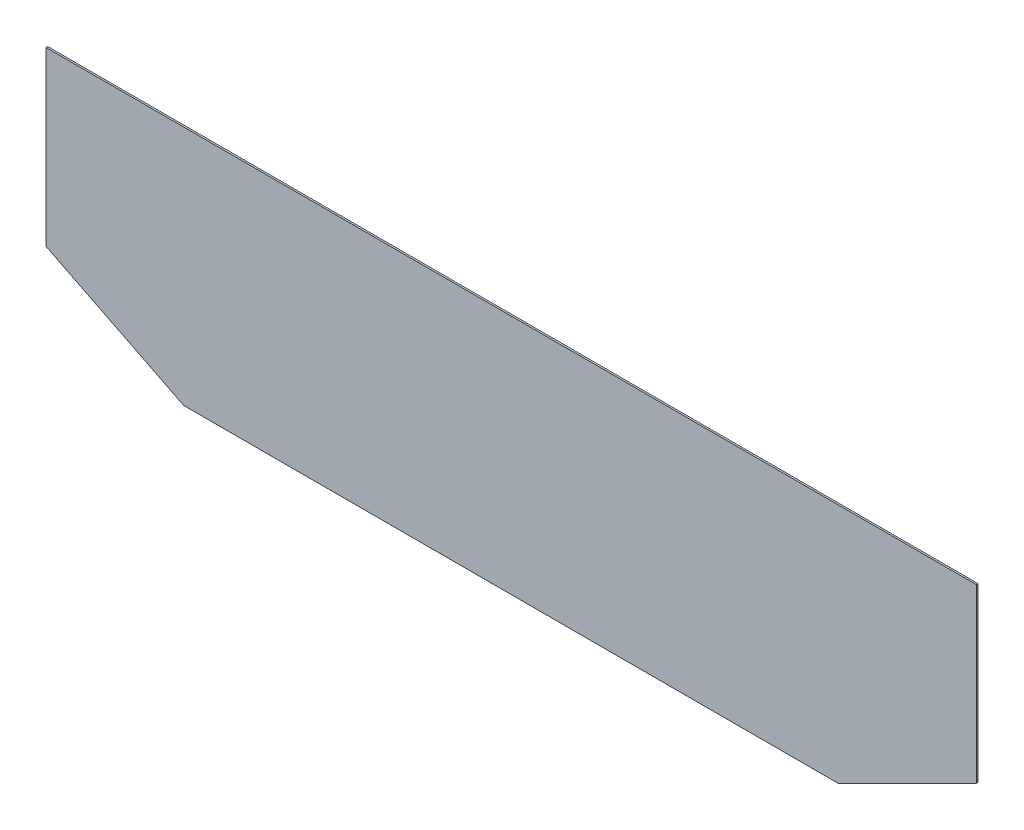
from build123d import *

# Parameters (mm, degrees)
BOSS_EXTRU_1_DEPTH = 0.5


with BuildPart() as part:
    # Esquisse1 → Boss.-Extru.1 (new body)
    with BuildSketch(Plane.XY):
        Polygon((135, 35), (-135, 35), (-135, -15), (-95, -35), (95, -35), (135, -15), align=None)
    extrude(amount=BOSS_EXTRU_1_DEPTH)


solid = part.part
